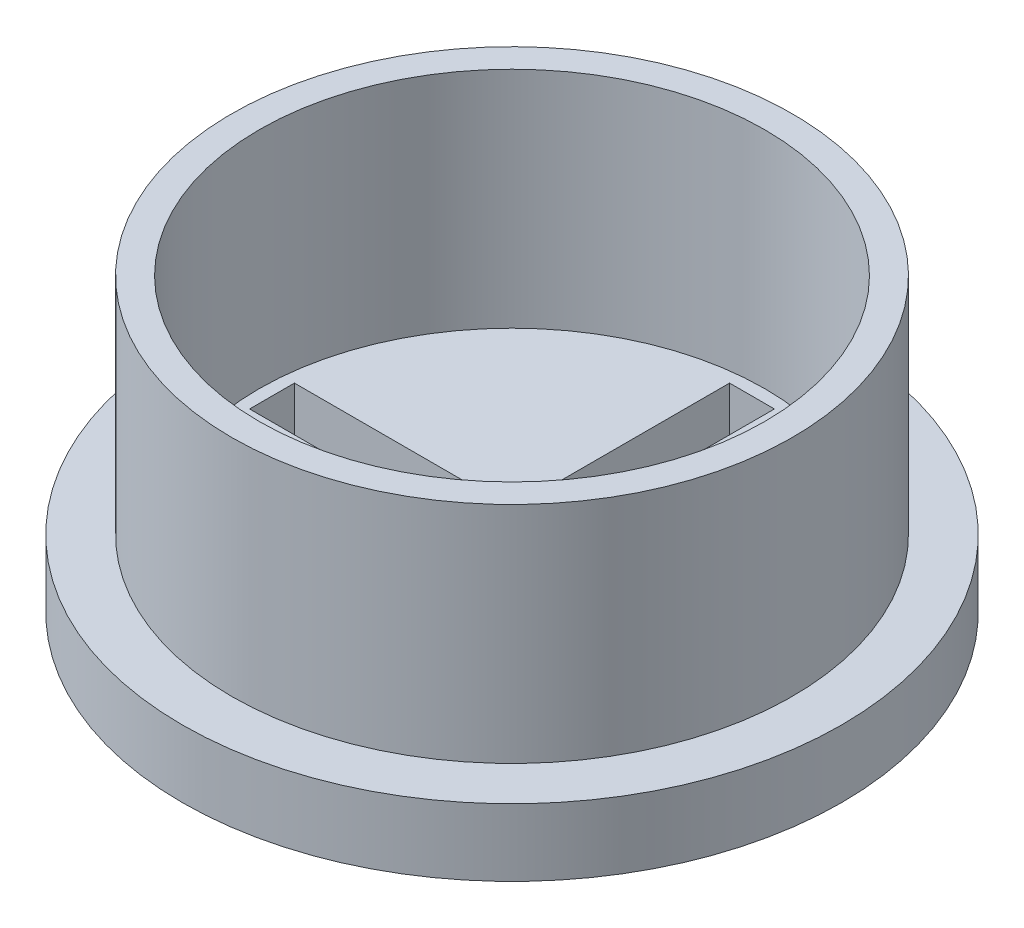
from build123d import *

# Parameters (mm, degrees)
SKETCH1_R           = 14.7
BOSS_EXTRUDE1_DEPTH = 3
SKETCH3_W           = 21.4
SKETCH3_H           = 2
CUT_EXTRUDE1_DEPTH  = 3
SKETCH4_W           = 2
SKETCH4_H           = 21.4
CUT_EXTRUDE2_DEPTH  = 3
SKETCH5_R           = 12.5
BOSS_EXTRUDE3_DEPTH = 10
SKETCH6_R           = 11.27
CUT_EXTRUDE3_DEPTH  = 10


with BuildPart() as part:
    # Sketch1 → Boss-Extrude1 (new body)
    with BuildSketch(Plane(origin=(0, 0, 0), x_dir=(1, 0, 0), z_dir=(0, 1, 0))):
        with Locations(Location((0, 0, 0), (0, 0, 270))):
            Circle(SKETCH1_R)
    extrude(amount=BOSS_EXTRUDE1_DEPTH)

    # Sketch3 → Cut-Extrude1 (cut)
    with BuildSketch(Plane(origin=(0, 3, 0), x_dir=(1, 0, 0), z_dir=(0, 1, 0))):
        Rectangle(SKETCH3_W, SKETCH3_H)
    extrude(amount=-CUT_EXTRUDE1_DEPTH, mode=Mode.SUBTRACT)

    # Sketch4 → Cut-Extrude2 (cut)
    with BuildSketch(Plane(origin=(0, 3, 0), x_dir=(1, 0, 0), z_dir=(0, 1, 0))):
        Rectangle(SKETCH4_W, SKETCH4_H)
    extrude(amount=-CUT_EXTRUDE2_DEPTH, mode=Mode.SUBTRACT)

    # Sketch5 → Boss-Extrude3 (add)
    with BuildSketch(Plane(origin=(0, 3, 0), x_dir=(1, 0, 0), z_dir=(0, 1, 0))):
        with Locations(Location((0, 0, 0), (0, 0, 270))):
            Circle(SKETCH5_R)
    extrude(amount=BOSS_EXTRUDE3_DEPTH)

    # Sketch6 → Cut-Extrude3 (cut)
    with BuildSketch(Plane(origin=(0, 13, 0), x_dir=(1, 0, 0), z_dir=(0, 1, 0))):
        with Locations(Location((0, 0, 0), (0, 0, 270))):
            Circle(SKETCH6_R)
    extrude(amount=-CUT_EXTRUDE3_DEPTH, mode=Mode.SUBTRACT)


solid = part.part
